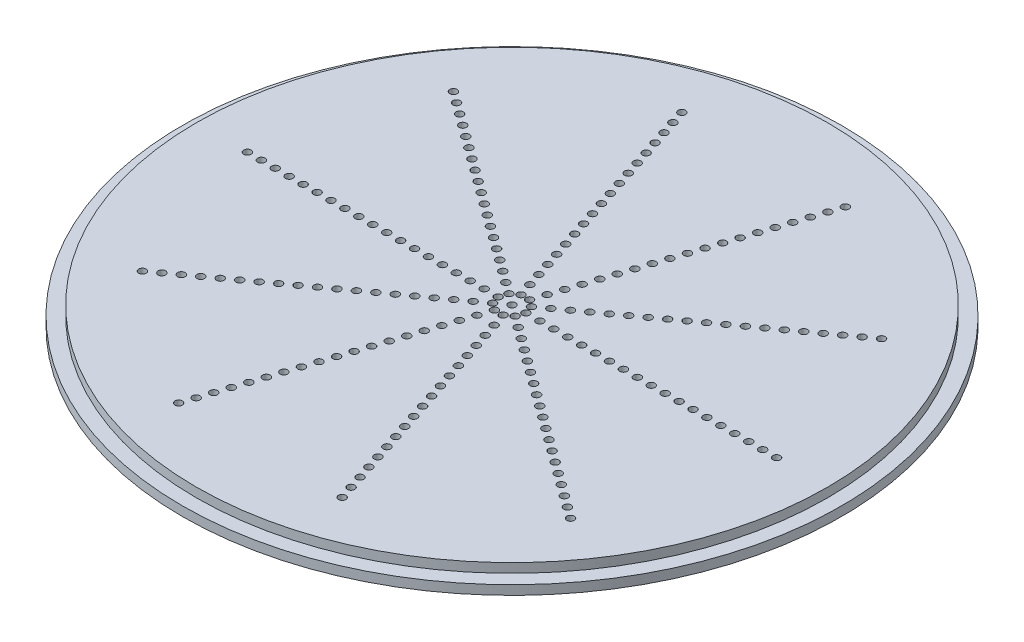
from build123d import *

# Parameters (mm, degrees)
CROQUIS1_R              = 34
SALIENTE_EXTRUIR1_DEPTH = 1
CROQUIS2_R              = 0.4
CORTAR_EXTRUIR1_DEPTH   = 49.093658626
CROQUIS3_R              = 35.5
CROQUIS3_R_2            = 34
SALIENTE_EXTRUIR2_DEPTH = 1


with BuildPart() as part:
    # Croquis1 → Saliente-Extruir1 (new body)
    with BuildSketch(Plane(origin=(0, 0, 0), x_dir=(1, 0, 0), z_dir=(0, 1, 0))):
        with Locations(Location((0, 0, 0), (0, 0, 270))):
            Circle(CROQUIS1_R)
    extrude(amount=SALIENTE_EXTRUIR1_DEPTH)

    # Croquis2 → Cortar-Extruir1 (cut, through all)
    with BuildSketch(Plane(origin=(0, 1, 0), x_dir=(1, 0, 0), z_dir=(0, 1, 0))):
        with Locations(Location((0, 0, 0), (0, 0, 270))):
            Circle(CROQUIS2_R)
        with Locations(Location((1.5, 0, 0), (0, 0, 270))):
            Circle(CROQUIS2_R)
        with Locations(Location((3, 0, 0), (0, 0, 270))):
            Circle(CROQUIS2_R)
        with Locations(Location((4.5, 0, 0), (0, 0, 270))):
            Circle(CROQUIS2_R)
        with Locations(Location((6, 0, 0), (0, 0, 270))):
            Circle(CROQUIS2_R)
        with Locations(Location((7.5, 0, 0), (0, 0, 270))):
            Circle(CROQUIS2_R)
        with Locations(Location((9, 0, 0), (0, 0, 270))):
            Circle(CROQUIS2_R)
        with Locations(Location((10.5, 0, 0), (0, 0, 270))):
            Circle(CROQUIS2_R)
        with Locations(Location((12, 0, 0), (0, 0, 270))):
            Circle(CROQUIS2_R)
        with Locations(Location((13.5, 0, 0), (0, 0, 270))):
            Circle(CROQUIS2_R)
        with Locations(Location((15, 0, 0), (0, 0, 270))):
            Circle(CROQUIS2_R)
        with Locations(Location((16.5, 0, 0), (0, 0, 270))):
            Circle(CROQUIS2_R)
        with Locations(Location((18, 0, 0), (0, 0, 270))):
            Circle(CROQUIS2_R)
        with Locations(Location((19.5, 0, 0), (0, 0, 270))):
            Circle(CROQUIS2_R)
        with Locations(Location((21, 0, 0), (0, 0, 270))):
            Circle(CROQUIS2_R)
        with Locations(Location((22.5, 0, 0), (0, 0, 270))):
            Circle(CROQUIS2_R)
        with Locations(Location((24, 0, 0), (0, 0, 270))):
            Circle(CROQUIS2_R)
        with Locations(Location((25.5, 0, 0), (0, 0, 270))):
            Circle(CROQUIS2_R)
        with Locations(Location((27, 0, 0), (0, 0, 270))):
            Circle(CROQUIS2_R)
        with Locations(Location((28.5, 0, 0), (0, 0, 270))):
            Circle(CROQUIS2_R)
        with Locations(Location((1.213525492, -0.881677878, 0), (0, 0, 270))):
            Circle(CROQUIS2_R)
        with Locations(Location((2.427050983, -1.763355757, 0), (0, 0, 270))):
            Circle(CROQUIS2_R)
        with Locations(Location((3.640576475, -2.645033635, 0), (0, 0, 270))):
            Circle(CROQUIS2_R)
        with Locations(Location((4.854101966, -3.526711514, 0), (0, 0, 270))):
            Circle(CROQUIS2_R)
        with Locations(Location((6.067627458, -4.408389392, 0), (0, 0, 270))):
            Circle(CROQUIS2_R)
        with Locations(Location((7.281152949, -5.290067271, 0), (0, 0, 270))):
            Circle(CROQUIS2_R)
        with Locations(Location((8.494678441, -6.171745149, 0), (0, 0, 270))):
            Circle(CROQUIS2_R)
        with Locations(Location((9.708203932, -7.053423028, 0), (0, 0, 270))):
            Circle(CROQUIS2_R)
        with Locations(Location((10.921729424, -7.935100906, 0), (0, 0, 270))):
            Circle(CROQUIS2_R)
        with Locations(Location((12.135254916, -8.816778784, 0), (0, 0, 270))):
            Circle(CROQUIS2_R)
        with Locations(Location((13.348780407, -9.698456663, 0), (0, 0, 270))):
            Circle(CROQUIS2_R)
        with Locations(Location((14.562305899, -10.580134541, 0), (0, 0, 270))):
            Circle(CROQUIS2_R)
        with Locations(Location((15.77583139, -11.46181242, 0), (0, 0, 270))):
            Circle(CROQUIS2_R)
        with Locations(Location((16.989356882, -12.343490298, 0), (0, 0, 270))):
            Circle(CROQUIS2_R)
        with Locations(Location((18.202882373, -13.225168177, 0), (0, 0, 270))):
            Circle(CROQUIS2_R)
        with Locations(Location((19.416407865, -14.106846055, 0), (0, 0, 270))):
            Circle(CROQUIS2_R)
        with Locations(Location((20.629933357, -14.988523933, 0), (0, 0, 270))):
            Circle(CROQUIS2_R)
        with Locations(Location((21.843458848, -15.870201812, 0), (0, 0, 270))):
            Circle(CROQUIS2_R)
        with Locations(Location((23.05698434, -16.75187969, 0), (0, 0, 270))):
            Circle(CROQUIS2_R)
        with Locations(Location((0.463525492, -1.426584774, 0), (0, 0, 270))):
            Circle(CROQUIS2_R)
        with Locations(Location((0.927050983, -2.853169549, 0), (0, 0, 270))):
            Circle(CROQUIS2_R)
        with Locations(Location((1.390576475, -4.279754323, 0), (0, 0, 270))):
            Circle(CROQUIS2_R)
        with Locations(Location((1.854101966, -5.706339098, 0), (0, 0, 270))):
            Circle(CROQUIS2_R)
        with Locations(Location((2.317627458, -7.132923872, 0), (0, 0, 270))):
            Circle(CROQUIS2_R)
        with Locations(Location((2.781152949, -8.559508647, 0), (0, 0, 270))):
            Circle(CROQUIS2_R)
        with Locations(Location((3.244678441, -9.986093421, 0), (0, 0, 270))):
            Circle(CROQUIS2_R)
        with Locations(Location((3.708203932, -11.412678196, 0), (0, 0, 270))):
            Circle(CROQUIS2_R)
        with Locations(Location((4.171729424, -12.83926297, 0), (0, 0, 270))):
            Circle(CROQUIS2_R)
        with Locations(Location((4.635254916, -14.265847744, 0), (0, 0, 270))):
            Circle(CROQUIS2_R)
        with Locations(Location((5.098780407, -15.692432519, 0), (0, 0, 270))):
            Circle(CROQUIS2_R)
        with Locations(Location((5.562305899, -17.119017293, 0), (0, 0, 270))):
            Circle(CROQUIS2_R)
        with Locations(Location((6.02583139, -18.545602068, 0), (0, 0, 270))):
            Circle(CROQUIS2_R)
        with Locations(Location((6.489356882, -19.972186842, 0), (0, 0, 270))):
            Circle(CROQUIS2_R)
        with Locations(Location((6.952882373, -21.398771617, 0), (0, 0, 270))):
            Circle(CROQUIS2_R)
        with Locations(Location((7.416407865, -22.825356391, 0), (0, 0, 270))):
            Circle(CROQUIS2_R)
        with Locations(Location((7.879933357, -24.251941166, 0), (0, 0, 270))):
            Circle(CROQUIS2_R)
        with Locations(Location((8.343458848, -25.67852594, 0), (0, 0, 270))):
            Circle(CROQUIS2_R)
        with Locations(Location((8.80698434, -27.105110714, 0), (0, 0, 270))):
            Circle(CROQUIS2_R)
        with Locations(Location((-0.463525492, -1.426584774, 0), (0, 0, 270))):
            Circle(CROQUIS2_R)
        with Locations(Location((-0.927050983, -2.853169549, 0), (0, 0, 270))):
            Circle(CROQUIS2_R)
        with Locations(Location((-1.390576475, -4.279754323, 0), (0, 0, 270))):
            Circle(CROQUIS2_R)
        with Locations(Location((-1.854101966, -5.706339098, 0), (0, 0, 270))):
            Circle(CROQUIS2_R)
        with Locations(Location((-2.317627458, -7.132923872, 0), (0, 0, 270))):
            Circle(CROQUIS2_R)
        with Locations(Location((-2.781152949, -8.559508647, 0), (0, 0, 270))):
            Circle(CROQUIS2_R)
        with Locations(Location((-3.244678441, -9.986093421, 0), (0, 0, 270))):
            Circle(CROQUIS2_R)
        with Locations(Location((-3.708203932, -11.412678196, 0), (0, 0, 270))):
            Circle(CROQUIS2_R)
        with Locations(Location((-4.171729424, -12.83926297, 0), (0, 0, 270))):
            Circle(CROQUIS2_R)
        with Locations(Location((-4.635254916, -14.265847744, 0), (0, 0, 270))):
            Circle(CROQUIS2_R)
        with Locations(Location((-5.098780407, -15.692432519, 0), (0, 0, 270))):
            Circle(CROQUIS2_R)
        with Locations(Location((-5.562305899, -17.119017293, 0), (0, 0, 270))):
            Circle(CROQUIS2_R)
        with Locations(Location((-6.02583139, -18.545602068, 0), (0, 0, 270))):
            Circle(CROQUIS2_R)
        with Locations(Location((-6.489356882, -19.972186842, 0), (0, 0, 270))):
            Circle(CROQUIS2_R)
        with Locations(Location((-6.952882373, -21.398771617, 0), (0, 0, 270))):
            Circle(CROQUIS2_R)
        with Locations(Location((-7.416407865, -22.825356391, 0), (0, 0, 270))):
            Circle(CROQUIS2_R)
        with Locations(Location((-7.879933357, -24.251941166, 0), (0, 0, 270))):
            Circle(CROQUIS2_R)
        with Locations(Location((-8.343458848, -25.67852594, 0), (0, 0, 270))):
            Circle(CROQUIS2_R)
        with Locations(Location((-8.80698434, -27.105110714, 0), (0, 0, 270))):
            Circle(CROQUIS2_R)
        with Locations(Location((-1.213525492, -0.881677878, 0), (0, 0, 270))):
            Circle(CROQUIS2_R)
        with Locations(Location((-2.427050983, -1.763355757, 0), (0, 0, 270))):
            Circle(CROQUIS2_R)
        with Locations(Location((-3.640576475, -2.645033635, 0), (0, 0, 270))):
            Circle(CROQUIS2_R)
        with Locations(Location((-4.854101966, -3.526711514, 0), (0, 0, 270))):
            Circle(CROQUIS2_R)
        with Locations(Location((-6.067627458, -4.408389392, 0), (0, 0, 270))):
            Circle(CROQUIS2_R)
        with Locations(Location((-7.281152949, -5.290067271, 0), (0, 0, 270))):
            Circle(CROQUIS2_R)
        with Locations(Location((-8.494678441, -6.171745149, 0), (0, 0, 270))):
            Circle(CROQUIS2_R)
        with Locations(Location((-9.708203932, -7.053423028, 0), (0, 0, 270))):
            Circle(CROQUIS2_R)
        with Locations(Location((-10.921729424, -7.935100906, 0), (0, 0, 270))):
            Circle(CROQUIS2_R)
        with Locations(Location((-12.135254916, -8.816778784, 0), (0, 0, 270))):
            Circle(CROQUIS2_R)
        with Locations(Location((-13.348780407, -9.698456663, 0), (0, 0, 270))):
            Circle(CROQUIS2_R)
        with Locations(Location((-14.562305899, -10.580134541, 0), (0, 0, 270))):
            Circle(CROQUIS2_R)
        with Locations(Location((-15.77583139, -11.46181242, 0), (0, 0, 270))):
            Circle(CROQUIS2_R)
        with Locations(Location((-16.989356882, -12.343490298, 0), (0, 0, 270))):
            Circle(CROQUIS2_R)
        with Locations(Location((-18.202882373, -13.225168177, 0), (0, 0, 270))):
            Circle(CROQUIS2_R)
        with Locations(Location((-19.416407865, -14.106846055, 0), (0, 0, 270))):
            Circle(CROQUIS2_R)
        with Locations(Location((-20.629933357, -14.988523933, 0), (0, 0, 270))):
            Circle(CROQUIS2_R)
        with Locations(Location((-21.843458848, -15.870201812, 0), (0, 0, 270))):
            Circle(CROQUIS2_R)
        with Locations(Location((-23.05698434, -16.75187969, 0), (0, 0, 270))):
            Circle(CROQUIS2_R)
        with Locations(Location((-1.5, 0, 0), (0, 0, 270))):
            Circle(CROQUIS2_R)
        with Locations(Location((-3, 0, 0), (0, 0, 270))):
            Circle(CROQUIS2_R)
        with Locations(Location((-4.5, 0, 0), (0, 0, 270))):
            Circle(CROQUIS2_R)
        with Locations(Location((-6, 0, 0), (0, 0, 270))):
            Circle(CROQUIS2_R)
        with Locations(Location((-7.5, 0, 0), (0, 0, 270))):
            Circle(CROQUIS2_R)
        with Locations(Location((-9, 0, 0), (0, 0, 270))):
            Circle(CROQUIS2_R)
        with Locations(Location((-10.5, 0, 0), (0, 0, 270))):
            Circle(CROQUIS2_R)
        with Locations(Location((-12, 0, 0), (0, 0, 270))):
            Circle(CROQUIS2_R)
        with Locations(Location((-13.5, 0, 0), (0, 0, 270))):
            Circle(CROQUIS2_R)
        with Locations(Location((-15, 0, 0), (0, 0, 270))):
            Circle(CROQUIS2_R)
        with Locations(Location((-16.5, 0, 0), (0, 0, 270))):
            Circle(CROQUIS2_R)
        with Locations(Location((-18, 0, 0), (0, 0, 270))):
            Circle(CROQUIS2_R)
        with Locations(Location((-19.5, 0, 0), (0, 0, 270))):
            Circle(CROQUIS2_R)
        with Locations(Location((-21, 0, 0), (0, 0, 270))):
            Circle(CROQUIS2_R)
        with Locations(Location((-22.5, 0, 0), (0, 0, 270))):
            Circle(CROQUIS2_R)
        with Locations(Location((-24, 0, 0), (0, 0, 270))):
            Circle(CROQUIS2_R)
        with Locations(Location((-25.5, 0, 0), (0, 0, 270))):
            Circle(CROQUIS2_R)
        with Locations(Location((-27, 0, 0), (0, 0, 270))):
            Circle(CROQUIS2_R)
        with Locations(Location((-28.5, 0, 0), (0, 0, 270))):
            Circle(CROQUIS2_R)
        with Locations(Location((-1.213525492, 0.881677878, 0), (0, 0, 270))):
            Circle(CROQUIS2_R)
        with Locations(Location((-2.427050983, 1.763355757, 0), (0, 0, 270))):
            Circle(CROQUIS2_R)
        with Locations(Location((-3.640576475, 2.645033635, 0), (0, 0, 270))):
            Circle(CROQUIS2_R)
        with Locations(Location((-4.854101966, 3.526711514, 0), (0, 0, 270))):
            Circle(CROQUIS2_R)
        with Locations(Location((-6.067627458, 4.408389392, 0), (0, 0, 270))):
            Circle(CROQUIS2_R)
        with Locations(Location((-7.281152949, 5.290067271, 0), (0, 0, 270))):
            Circle(CROQUIS2_R)
        with Locations(Location((-8.494678441, 6.171745149, 0), (0, 0, 270))):
            Circle(CROQUIS2_R)
        with Locations(Location((-9.708203932, 7.053423028, 0), (0, 0, 270))):
            Circle(CROQUIS2_R)
        with Locations(Location((-10.921729424, 7.935100906, 0), (0, 0, 270))):
            Circle(CROQUIS2_R)
        with Locations(Location((-12.135254916, 8.816778784, 0), (0, 0, 270))):
            Circle(CROQUIS2_R)
        with Locations(Location((-13.348780407, 9.698456663, 0), (0, 0, 270))):
            Circle(CROQUIS2_R)
        with Locations(Location((-14.562305899, 10.580134541, 0), (0, 0, 270))):
            Circle(CROQUIS2_R)
        with Locations(Location((-15.77583139, 11.46181242, 0), (0, 0, 270))):
            Circle(CROQUIS2_R)
        with Locations(Location((-16.989356882, 12.343490298, 0), (0, 0, 270))):
            Circle(CROQUIS2_R)
        with Locations(Location((-18.202882373, 13.225168177, 0), (0, 0, 270))):
            Circle(CROQUIS2_R)
        with Locations(Location((-19.416407865, 14.106846055, 0), (0, 0, 270))):
            Circle(CROQUIS2_R)
        with Locations(Location((-20.629933357, 14.988523933, 0), (0, 0, 270))):
            Circle(CROQUIS2_R)
        with Locations(Location((-21.843458848, 15.870201812, 0), (0, 0, 270))):
            Circle(CROQUIS2_R)
        with Locations(Location((-23.05698434, 16.75187969, 0), (0, 0, 270))):
            Circle(CROQUIS2_R)
        with Locations(Location((-0.463525492, 1.426584774, 0), (0, 0, 270))):
            Circle(CROQUIS2_R)
        with Locations(Location((-0.927050983, 2.853169549, 0), (0, 0, 270))):
            Circle(CROQUIS2_R)
        with Locations(Location((-1.390576475, 4.279754323, 0), (0, 0, 270))):
            Circle(CROQUIS2_R)
        with Locations(Location((-1.854101966, 5.706339098, 0), (0, 0, 270))):
            Circle(CROQUIS2_R)
        with Locations(Location((-2.317627458, 7.132923872, 0), (0, 0, 270))):
            Circle(CROQUIS2_R)
        with Locations(Location((-2.781152949, 8.559508647, 0), (0, 0, 270))):
            Circle(CROQUIS2_R)
        with Locations(Location((-3.244678441, 9.986093421, 0), (0, 0, 270))):
            Circle(CROQUIS2_R)
        with Locations(Location((-3.708203932, 11.412678196, 0), (0, 0, 270))):
            Circle(CROQUIS2_R)
        with Locations(Location((-4.171729424, 12.83926297, 0), (0, 0, 270))):
            Circle(CROQUIS2_R)
        with Locations(Location((-4.635254916, 14.265847744, 0), (0, 0, 270))):
            Circle(CROQUIS2_R)
        with Locations(Location((-5.098780407, 15.692432519, 0), (0, 0, 270))):
            Circle(CROQUIS2_R)
        with Locations(Location((-5.562305899, 17.119017293, 0), (0, 0, 270))):
            Circle(CROQUIS2_R)
        with Locations(Location((-6.02583139, 18.545602068, 0), (0, 0, 270))):
            Circle(CROQUIS2_R)
        with Locations(Location((-6.489356882, 19.972186842, 0), (0, 0, 270))):
            Circle(CROQUIS2_R)
        with Locations(Location((-6.952882373, 21.398771617, 0), (0, 0, 270))):
            Circle(CROQUIS2_R)
        with Locations(Location((-7.416407865, 22.825356391, 0), (0, 0, 270))):
            Circle(CROQUIS2_R)
        with Locations(Location((-7.879933357, 24.251941166, 0), (0, 0, 270))):
            Circle(CROQUIS2_R)
        with Locations(Location((-8.343458848, 25.67852594, 0), (0, 0, 270))):
            Circle(CROQUIS2_R)
        with Locations(Location((-8.80698434, 27.105110714, 0), (0, 0, 270))):
            Circle(CROQUIS2_R)
        with Locations(Location((0.463525492, 1.426584774, 0), (0, 0, 270))):
            Circle(CROQUIS2_R)
        with Locations(Location((0.927050983, 2.853169549, 0), (0, 0, 270))):
            Circle(CROQUIS2_R)
        with Locations(Location((1.390576475, 4.279754323, 0), (0, 0, 270))):
            Circle(CROQUIS2_R)
        with Locations(Location((1.854101966, 5.706339098, 0), (0, 0, 270))):
            Circle(CROQUIS2_R)
        with Locations(Location((2.317627458, 7.132923872, 0), (0, 0, 270))):
            Circle(CROQUIS2_R)
        with Locations(Location((2.781152949, 8.559508647, 0), (0, 0, 270))):
            Circle(CROQUIS2_R)
        with Locations(Location((3.244678441, 9.986093421, 0), (0, 0, 270))):
            Circle(CROQUIS2_R)
        with Locations(Location((3.708203932, 11.412678196, 0), (0, 0, 270))):
            Circle(CROQUIS2_R)
        with Locations(Location((4.171729424, 12.83926297, 0), (0, 0, 270))):
            Circle(CROQUIS2_R)
        with Locations(Location((4.635254916, 14.265847744, 0), (0, 0, 270))):
            Circle(CROQUIS2_R)
        with Locations(Location((5.098780407, 15.692432519, 0), (0, 0, 270))):
            Circle(CROQUIS2_R)
        with Locations(Location((5.562305899, 17.119017293, 0), (0, 0, 270))):
            Circle(CROQUIS2_R)
        with Locations(Location((6.02583139, 18.545602068, 0), (0, 0, 270))):
            Circle(CROQUIS2_R)
        with Locations(Location((6.489356882, 19.972186842, 0), (0, 0, 270))):
            Circle(CROQUIS2_R)
        with Locations(Location((6.952882373, 21.398771617, 0), (0, 0, 270))):
            Circle(CROQUIS2_R)
        with Locations(Location((7.416407865, 22.825356391, 0), (0, 0, 270))):
            Circle(CROQUIS2_R)
        with Locations(Location((7.879933357, 24.251941166, 0), (0, 0, 270))):
            Circle(CROQUIS2_R)
        with Locations(Location((8.343458848, 25.67852594, 0), (0, 0, 270))):
            Circle(CROQUIS2_R)
        with Locations(Location((8.80698434, 27.105110714, 0), (0, 0, 270))):
            Circle(CROQUIS2_R)
        with Locations(Location((1.213525492, 0.881677878, 0), (0, 0, 270))):
            Circle(CROQUIS2_R)
        with Locations(Location((2.427050983, 1.763355757, 0), (0, 0, 270))):
            Circle(CROQUIS2_R)
        with Locations(Location((3.640576475, 2.645033635, 0), (0, 0, 270))):
            Circle(CROQUIS2_R)
        with Locations(Location((4.854101966, 3.526711514, 0), (0, 0, 270))):
            Circle(CROQUIS2_R)
        with Locations(Location((6.067627458, 4.408389392, 0), (0, 0, 270))):
            Circle(CROQUIS2_R)
        with Locations(Location((7.281152949, 5.290067271, 0), (0, 0, 270))):
            Circle(CROQUIS2_R)
        with Locations(Location((8.494678441, 6.171745149, 0), (0, 0, 270))):
            Circle(CROQUIS2_R)
        with Locations(Location((9.708203932, 7.053423028, 0), (0, 0, 270))):
            Circle(CROQUIS2_R)
        with Locations(Location((10.921729424, 7.935100906, 0), (0, 0, 270))):
            Circle(CROQUIS2_R)
        with Locations(Location((12.135254916, 8.816778784, 0), (0, 0, 270))):
            Circle(CROQUIS2_R)
        with Locations(Location((13.348780407, 9.698456663, 0), (0, 0, 270))):
            Circle(CROQUIS2_R)
        with Locations(Location((14.562305899, 10.580134541, 0), (0, 0, 270))):
            Circle(CROQUIS2_R)
        with Locations(Location((15.77583139, 11.46181242, 0), (0, 0, 270))):
            Circle(CROQUIS2_R)
        with Locations(Location((16.989356882, 12.343490298, 0), (0, 0, 270))):
            Circle(CROQUIS2_R)
        with Locations(Location((18.202882373, 13.225168177, 0), (0, 0, 270))):
            Circle(CROQUIS2_R)
        with Locations(Location((19.416407865, 14.106846055, 0), (0, 0, 270))):
            Circle(CROQUIS2_R)
        with Locations(Location((20.629933357, 14.988523933, 0), (0, 0, 270))):
            Circle(CROQUIS2_R)
        with Locations(Location((21.843458848, 15.870201812, 0), (0, 0, 270))):
            Circle(CROQUIS2_R)
        with Locations(Location((23.05698434, 16.75187969, 0), (0, 0, 270))):
            Circle(CROQUIS2_R)
    extrude(amount=-CORTAR_EXTRUIR1_DEPTH, mode=Mode.SUBTRACT)


with BuildPart() as body_2:
    # Croquis3 → Saliente-Extruir2 (new body)
    with BuildSketch(Plane(origin=(0, 0, 0), x_dir=(1, 0, 0), z_dir=(0, 1, 0))):
        with Locations(Location((0, 0, 0), (0, 0, 270))):
            Circle(CROQUIS3_R)
        with Locations(Location((0, 0, 0), (0, 0, 270))):
            Circle(CROQUIS3_R_2, mode=Mode.SUBTRACT)
    extrude(amount=-SALIENTE_EXTRUIR2_DEPTH)


solid = Compound([part.part, body_2.part])
